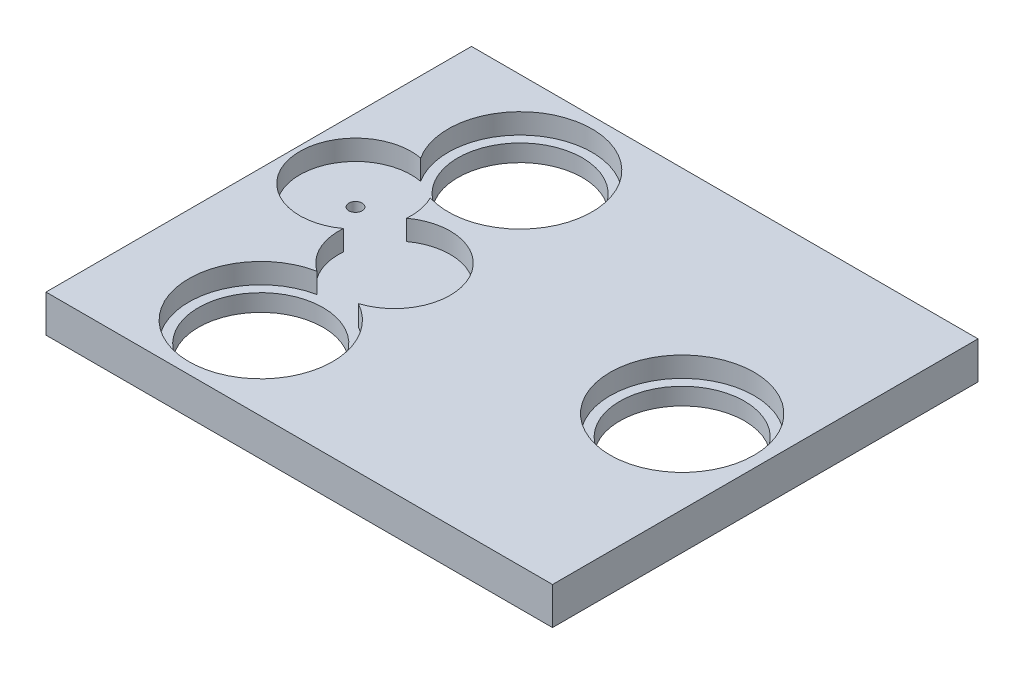
from build123d import *

# Parameters (mm, degrees)
SKETCH1_W                                      = 125
SKETCH1_H                                      = 105
TEST_BASE_POSTION_DEPTH                        = 9.215
THUMB_KNUCKLE_MOUNT_START                      = -4.215
SKETCH7_R                                      = 17.75
THUMB_KNUCKLE_MOUNT_DEPTH                      = 5
SKETCH8_R                                      = 15.375
THUMB_KNUCKLE_DEPTH                            = 4.215
GEARS_POSITION_EXTRUDE_CUT_START               = -4.215
SKETCH10_R                                     = 13.75
SKETCH10_R_2                                   = 17.75
GEARS_POSITION_EXTRUDE_CUT_DEPTH               = 5
SKETCH11_R                                     = 15.375
SKETCH11_R_2                                   = 1.65
FINGERS_KNUCKLE_MOUNT_AND_INTERMEDIATE_T_DEPTH = 83.142657767


with BuildPart() as part:
    # Sketch1 → Test_Base_Postion (new body)
    with BuildSketch(Plane(origin=(0, 0, 0), x_dir=(1, 0, 0), z_dir=(0, 1, 0))):
        Rectangle(SKETCH1_W, SKETCH1_H)
    extrude(amount=TEST_BASE_POSTION_DEPTH)

    # Sketch7 → Thumb_Knuckle_Mount (cut)
    with BuildSketch(Plane.XZ.offset(THUMB_KNUCKLE_MOUNT_START)):
        with Locations(Location((42, 0, 0), (0, 0, 270))):
            Circle(SKETCH7_R)
    extrude(amount=-THUMB_KNUCKLE_MOUNT_DEPTH, mode=Mode.SUBTRACT)

    # Sketch8 → Thumb_Knuckle (cut)
    with BuildSketch(Plane.XZ):
        with Locations(Location((42, 0, 0), (0, 0, 270))):
            Circle(SKETCH8_R)
    extrude(amount=-THUMB_KNUCKLE_DEPTH, mode=Mode.SUBTRACT)

    # Sketch10 → Gears_Position_Extrude_Cut (cut)
    with BuildSketch(Plane.XZ.offset(GEARS_POSITION_EXTRUDE_CUT_START)):
        with Locations((-25.678431211, 3.323807031)):
            Circle(SKETCH10_R)
        with Locations((-30, 32)):
            Circle(SKETCH10_R_2)
        with Locations((-47.5, -8.87533784)):
            Circle(SKETCH10_R)
        with Locations((-30, -32)):
            Circle(SKETCH10_R_2)
    extrude(amount=-GEARS_POSITION_EXTRUDE_CUT_DEPTH, mode=Mode.SUBTRACT)

    # Sketch11 → Fingers_Knuckle_Mount_and_Intermediate_Through_Hole (cut, through all)
    with BuildSketch(Plane.XZ):
        with Locations(Location((-30, 32, 0), (0, 0, 270))):
            Circle(SKETCH11_R)
        with Locations(Location((-30, -32, 0), (0, 0, 270))):
            Circle(SKETCH11_R)
        with Locations(Location((-47.5, -8.87533784, 0), (0, 0, 270))):
            Circle(SKETCH11_R_2)
    extrude(amount=-FINGERS_KNUCKLE_MOUNT_AND_INTERMEDIATE_T_DEPTH, mode=Mode.SUBTRACT)


solid = part.part
